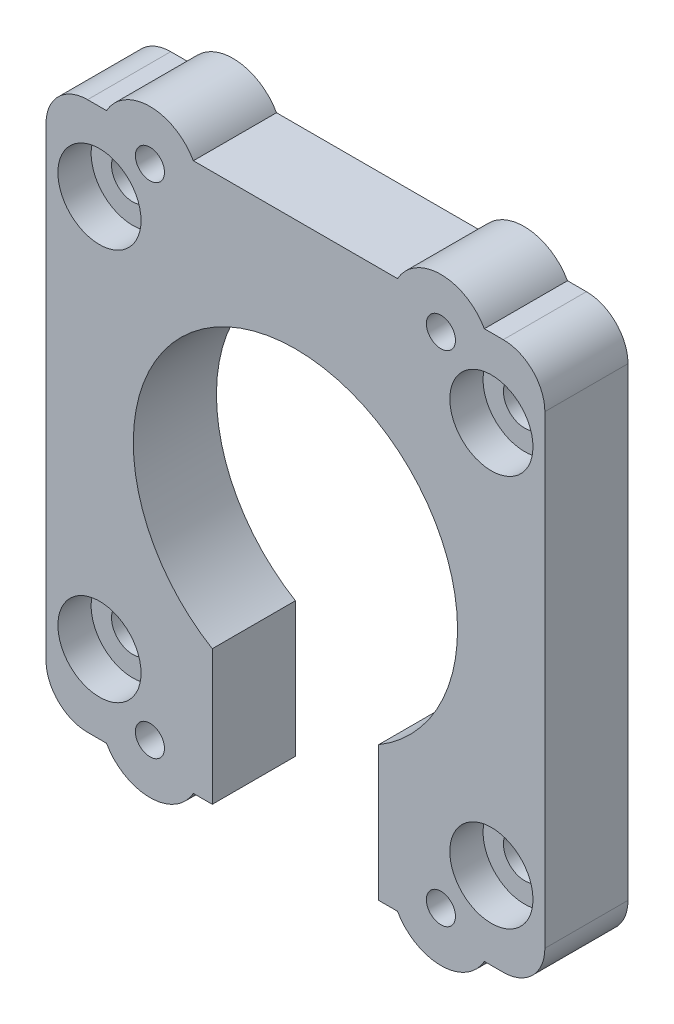
from build123d import *

# Parameters (mm, degrees)
RESSALTO_EXTRUS_O1_DEPTH = 10
ESBO_O2_R                = 2.55
CORTE_EXTRUS_O1_DEPTH    = 10
ESBO_O4_R                = 19.5
CORTE_EXTRUS_O3_DEPTH    = 10
ESBO_O5_W                = 20
ESBO_O5_H                = 10
CORTE_EXTRUS_O4_DEPTH    = 30
ESBO_O6_R                = 1.75
CORTE_EXTRUS_O5_DEPTH    = 10
ESBO_O7_R                = 6
ESBO_O7_R_2              = 1.75
RESSALTO_EXTRUS_O2_DEPTH = 10
ESBO_O9_R                = 5
CORTE_EXTRUS_O6_DEPTH    = 4
ESBO_O10_R               = 3.5
CORTE_EXTRUS_O7_DEPTH    = 4


with BuildPart() as part:
    # Esboço1 → Ressalto-extrusão1 (new body)
    with BuildSketch(Plane.XY):
        with BuildLine():
            Line((25, -32.950849719), (-25, -32.950849719))
            ThreePointArc((-25, -32.950849719), (-28.535533906, -31.486383625), (-30, -27.950849719))
            Line((-30, -27.950849719), (-30, 27.950849719))
            ThreePointArc((-30, 27.950849719), (-28.535533906, 31.486383625), (-25, 32.950849719))
            Line((-25, 32.950849719), (25, 32.950849719))
            ThreePointArc((25, 32.950849719), (28.535533906, 31.486383625), (30, 27.950849719))
            Line((30, 27.950849719), (30, -27.950849719))
            ThreePointArc((30, -27.950849719), (28.535533906, -31.486383625), (25, -32.950849719))
        make_face()
    extrude(amount=RESSALTO_EXTRUS_O1_DEPTH)

    # Esboço2 → Corte-extrusão1 (cut)
    with BuildSketch(Plane.XY.offset(10)):
        with Locations((-23.57, 23.57)):
            Circle(ESBO_O2_R)
        with Locations((23.57, 23.57)):
            Circle(ESBO_O2_R)
        with Locations((23.57, -23.57)):
            Circle(ESBO_O2_R)
        with Locations((-23.57, -23.57)):
            Circle(ESBO_O2_R)
    extrude(amount=-CORTE_EXTRUS_O1_DEPTH, mode=Mode.SUBTRACT)

    # Esboço4 → Corte-extrusão3 (cut)
    with BuildSketch(Plane.XY.offset(10)):
        Circle(ESBO_O4_R)
    extrude(amount=-CORTE_EXTRUS_O3_DEPTH, mode=Mode.SUBTRACT)

    # Esboço5 → Corte-extrusão4 (cut)
    with BuildSketch(Plane.XZ.offset(32.950849719)):
        with Locations((0, 5)):
            Rectangle(ESBO_O5_W, ESBO_O5_H)
    extrude(amount=-CORTE_EXTRUS_O4_DEPTH, mode=Mode.SUBTRACT)

    # Esboço6 → Corte-extrusão5 (cut)
    with BuildSketch(Plane(origin=(0, 0, 0), x_dir=(-1, 0, 0), z_dir=(0, 0, -1))):
        with Locations((17.5, 30)):
            Circle(ESBO_O6_R)
        with Locations((-17.5, 30)):
            Circle(ESBO_O6_R)
        with Locations((-17.5, -30)):
            Circle(ESBO_O6_R)
        with Locations((17.5, -30)):
            Circle(ESBO_O6_R)
    extrude(amount=-CORTE_EXTRUS_O5_DEPTH, mode=Mode.SUBTRACT)

    # Esboço7 → Ressalto-extrusão2 (add)
    # profile 1 of 4: a face of its own
    with BuildSketch(Plane(origin=(0, 0, 0), x_dir=(-1, 0, 0), z_dir=(0, 0, -1))):
        with Locations((17.5, -30)):
            Circle(ESBO_O7_R)
        with Locations((17.5, -30)):
            Circle(ESBO_O7_R_2, mode=Mode.SUBTRACT)
    # profile 2 of 4: a face of its own
    with BuildSketch(Plane(origin=(0, 0, 0), x_dir=(-1, 0, 0), z_dir=(0, 0, -1))):
        with Locations((-17.5, -30)):
            Circle(ESBO_O7_R)
        with Locations((-17.5, -30)):
            Circle(ESBO_O7_R_2, mode=Mode.SUBTRACT)
    # profile 3 of 4: a face of its own
    with BuildSketch(Plane(origin=(0, 0, 0), x_dir=(-1, 0, 0), z_dir=(0, 0, -1))):
        with Locations((-17.5, 30)):
            Circle(ESBO_O7_R)
        with Locations((-17.5, 30)):
            Circle(ESBO_O7_R_2, mode=Mode.SUBTRACT)
    # profile 4 of 4: a face of its own
    with BuildSketch(Plane(origin=(0, 0, 0), x_dir=(-1, 0, 0), z_dir=(0, 0, -1))):
        with Locations((17.5, 30)):
            Circle(ESBO_O7_R)
        with Locations((17.5, 30)):
            Circle(ESBO_O7_R_2, mode=Mode.SUBTRACT)
    extrude(amount=-RESSALTO_EXTRUS_O2_DEPTH)

    # Esboço9 → Corte-extrusão6 (cut)
    with BuildSketch(Plane.XY.offset(10)):
        with Locations((23.57, 23.57)):
            Circle(ESBO_O9_R)
        with Locations((-23.57, 23.57)):
            Circle(ESBO_O9_R)
        with Locations((23.57, -23.57)):
            Circle(ESBO_O9_R)
        with Locations((-23.57, -23.57)):
            Circle(ESBO_O9_R)
    extrude(amount=-CORTE_EXTRUS_O6_DEPTH, mode=Mode.SUBTRACT)

    # Esboço10 → Corte-extrusão7 (cut)
    with BuildSketch(Plane(origin=(0, 0, 0), x_dir=(-1, 0, 0), z_dir=(0, 0, -1))):
        with Locations((-17.5, -30)):
            Circle(ESBO_O10_R)
        with Locations((17.5, -30)):
            Circle(ESBO_O10_R)
        with Locations((17.5, 30)):
            Circle(ESBO_O10_R)
        with Locations((-17.5, 30)):
            Circle(ESBO_O10_R)
    extrude(amount=-CORTE_EXTRUS_O7_DEPTH, mode=Mode.SUBTRACT)


solid = part.part
